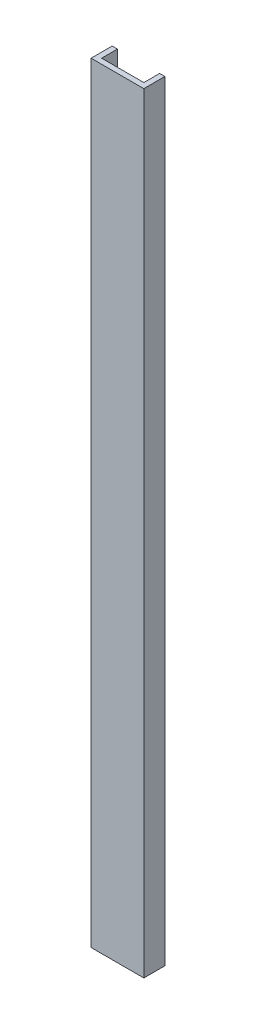
from build123d import *

# Parameters (mm, degrees)
BOSS_EXTRUDE1_DEPTH = 463.6135


with BuildPart() as part:
    # Sketch1 → Boss-Extrude1 (new body)
    with BuildSketch(Plane(origin=(0, 0, 0), x_dir=(1, 0, 0), z_dir=(0, 1, 0))):
        Polygon((3.175, 3.175), (3.175, 12.7), (0, 12.7), (0, 0), (31.75, 0), (31.75, 12.7), (28.575, 12.7), (28.575, 3.175), align=None)
    extrude(amount=BOSS_EXTRUDE1_DEPTH)


solid = part.part
